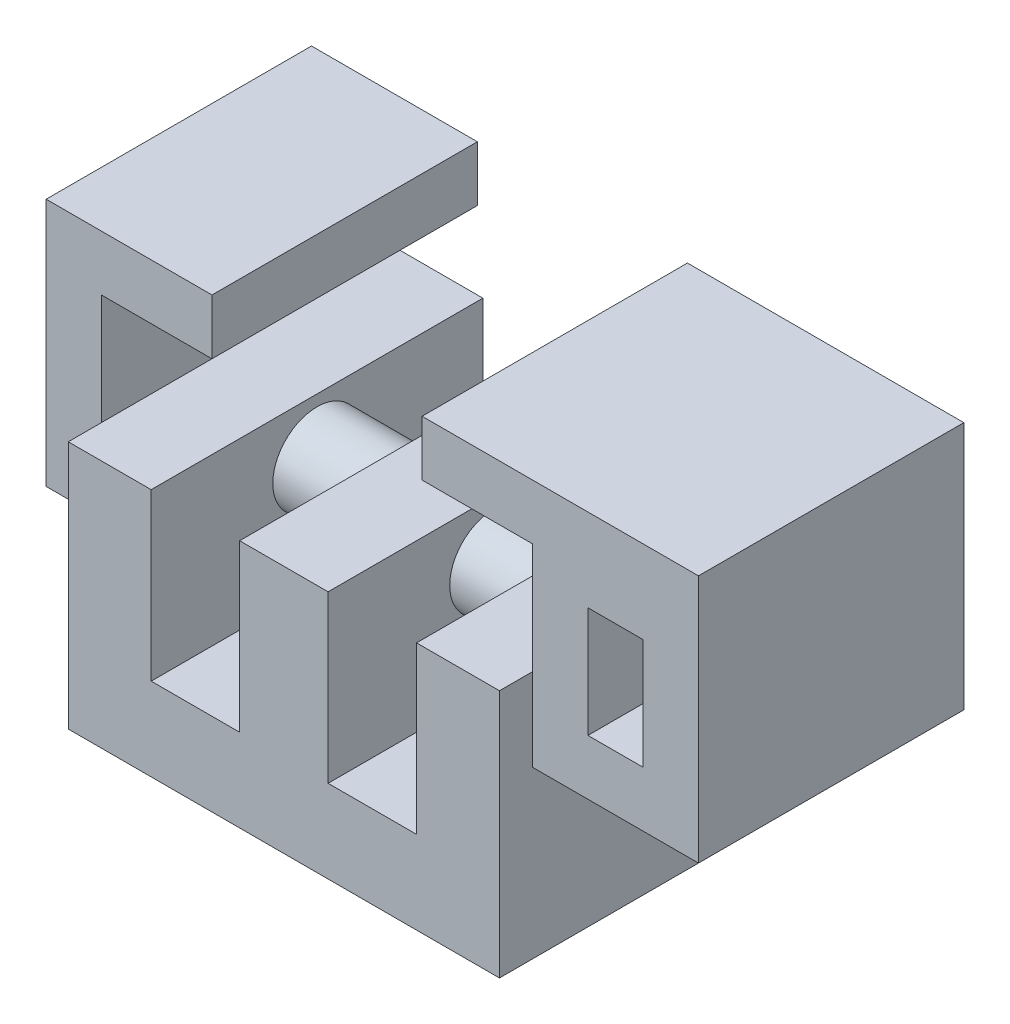
from build123d import *

# Parameters (mm, degrees)
BOSS_EXTRU_1_DEPTH      = 7.5
BOSS_EXTRU_1_DEPTH_BACK = 15
ESQUISSE1_W             = 39
ESQUISSE1_H             = 30
BOSS_EXTRU_2_DEPTH      = 22.5
ESQUISSE3_W             = 24
ESQUISSE3_H             = 5
BOSS_EXTRU_3_DEPTH      = 10
ESQUISSE4_W             = 24
ESQUISSE4_H             = 5
BOSS_EXTRU_4_DEPTH      = 10
ESQUISSE5_W             = 24
ESQUISSE5_H             = 22.5
BOSS_EXTRU_5_DEPTH      = 10
ESQUISSE6_W             = 5
ESQUISSE6_H             = 10
ENL_V_MAT_EXTRU_1_DEPTH = 50.249365478
ESQUISSE7_W             = 8
ESQUISSE7_H             = 30
ENL_V_MAT_EXTRU_2_DEPTH = 15
ESQUISSE8_R             = 4
BOSS_EXTRU_6_DEPTH      = 25
ESQUISSE9_W             = 20
ESQUISSE9_H             = 10
ENL_V_MAT_EXTRU_3_DEPTH = 5


with BuildPart() as part:
    # Esquisse1 → Boss.-Extru.1 (new, two sides: drawn at the far end of the back side and taken through both)
    with BuildSketch(Plane(origin=(0, 0, 0), x_dir=(1, 0, 0), z_dir=(0, 1, 0)).offset(-BOSS_EXTRU_1_DEPTH_BACK)):
        Rectangle(ESQUISSE1_W, ESQUISSE1_H)
    extrude(amount=BOSS_EXTRU_1_DEPTH + BOSS_EXTRU_1_DEPTH_BACK)

    # Esquisse2 → Boss.-Extru.2 (add)
    with BuildSketch(Plane(origin=(0, 0, 0), x_dir=(1, 0, 0), z_dir=(0, 1, 0))):
        Polygon((-19.5, 0), (-19.5, 12), (-24.5, 12), (-24.5, -12), (-19.5, -12), align=None)
        Polygon((19.5, 0), (19.5, 12), (24.5, 12), (24.5, -12), (19.5, -12), align=None)
    extrude(amount=BOSS_EXTRU_2_DEPTH)

    # Esquisse3 → Boss.-Extru.3 (add)
    with BuildSketch(Plane(origin=(-19.5, 0, 0), x_dir=(0, 0, -1), z_dir=(1, 0, 0))):
        with Locations((0, 20)):
            Rectangle(ESQUISSE3_W, ESQUISSE3_H)
    extrude(amount=BOSS_EXTRU_3_DEPTH)

    # Esquisse4 → Boss.-Extru.4 (add)
    with BuildSketch(Plane.ZY.offset(-19.5)):
        with Locations((0, 20)):
            Rectangle(ESQUISSE4_W, ESQUISSE4_H)
    extrude(amount=BOSS_EXTRU_4_DEPTH)

    # Esquisse5 → Boss.-Extru.5 (add)
    with BuildSketch(Plane(origin=(24.5, 0, 0), x_dir=(0, 0, -1), z_dir=(1, 0, 0))):
        with Locations((0, 11.25)):
            Rectangle(ESQUISSE5_W, ESQUISSE5_H)
    extrude(amount=BOSS_EXTRU_5_DEPTH)

    # Esquisse6 → Enlèv. mat.-Extru.1 (cut, through all)
    with BuildSketch(Plane(origin=(0, 0, -12), x_dir=(-1, 0, 0), z_dir=(0, 0, -1))):
        with Locations((-27, 10)):
            Rectangle(ESQUISSE6_W, ESQUISSE6_H)
    extrude(amount=-ENL_V_MAT_EXTRU_1_DEPTH, mode=Mode.SUBTRACT)

    # Esquisse7 → Enlèv. mat.-Extru.2 (cut)
    with BuildSketch(Plane(origin=(0, 7.5, 0), x_dir=(1, 0, 0), z_dir=(0, 1, 0))):
        with Locations((-8, 0)):
            Rectangle(ESQUISSE7_W, ESQUISSE7_H)
        with Locations((8, 0)):
            Rectangle(ESQUISSE7_W, ESQUISSE7_H)
    extrude(amount=-ENL_V_MAT_EXTRU_2_DEPTH, mode=Mode.SUBTRACT)

    # Esquisse8 → Boss.-Extru.6 (add)
    with BuildSketch(Plane(origin=(-12, 0, 0), x_dir=(0, 0, -1), z_dir=(1, 0, 0))):
        with Locations(Location((0, 2.490962546, 0), (0, 0, 180))):
            Circle(ESQUISSE8_R)
    extrude(amount=BOSS_EXTRU_6_DEPTH)

    # Esquisse9 → Enlèv. mat.-Extru.3 (cut)
    with BuildSketch(Plane.XZ.offset(15)):
        Rectangle(ESQUISSE9_W, ESQUISSE9_H)
    extrude(amount=-ENL_V_MAT_EXTRU_3_DEPTH, mode=Mode.SUBTRACT)


solid = part.part
